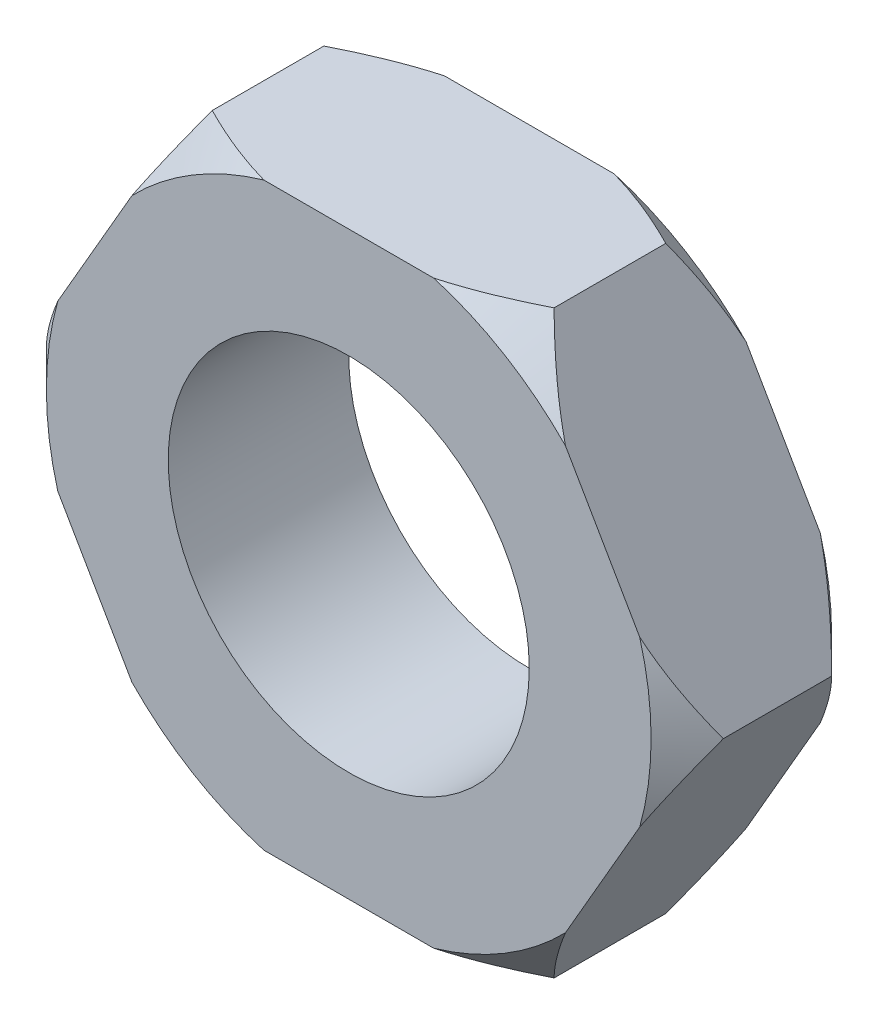
from build123d import *

# Parameters (mm, degrees)
ESQUISSE1_R             = 7.5
ESQUISSE1_R_2           = 4
BASE_EXTRUSION_DEPTH    = 4
CHANFREIN1_SIZE         = 0.8
ESQUISSE2_W             = 18
ESQUISSE2_H             = 18
ENL_V_MAT_EXTRU_1_DEPTH = 4


with BuildPart() as part:
    # Esquisse1 → Base-Extrusion (new body)
    with BuildSketch(Plane.XY):
        Circle(ESQUISSE1_R)
        Circle(ESQUISSE1_R_2, mode=Mode.SUBTRACT)
    extrude(amount=BASE_EXTRUSION_DEPTH)

    # Chanfrein1
    chanfrein1_edges = [part.edges().sort_by_distance(p)[0] for p in [
        (-7.5, 0, 0),
        (-7.5, 0, 4),
    ]]
    chamfer(chanfrein1_edges, length=CHANFREIN1_SIZE)

    # Esquisse2 → Enlèv. mat.-Extru.1 (cut)
    with BuildSketch(Plane.XY.offset(4)):
        Rectangle(ESQUISSE2_W, ESQUISSE2_H)
        Polygon((-7.5, 0), (-3.787466677, 6.43029634), (3.787466677, 6.43029634), (7.5, 0), (3.787466677, -6.43029634), (-3.787466677, -6.43029634), align=None, mode=Mode.SUBTRACT)
    extrude(amount=-ENL_V_MAT_EXTRU_1_DEPTH, mode=Mode.SUBTRACT)


solid = part.part
